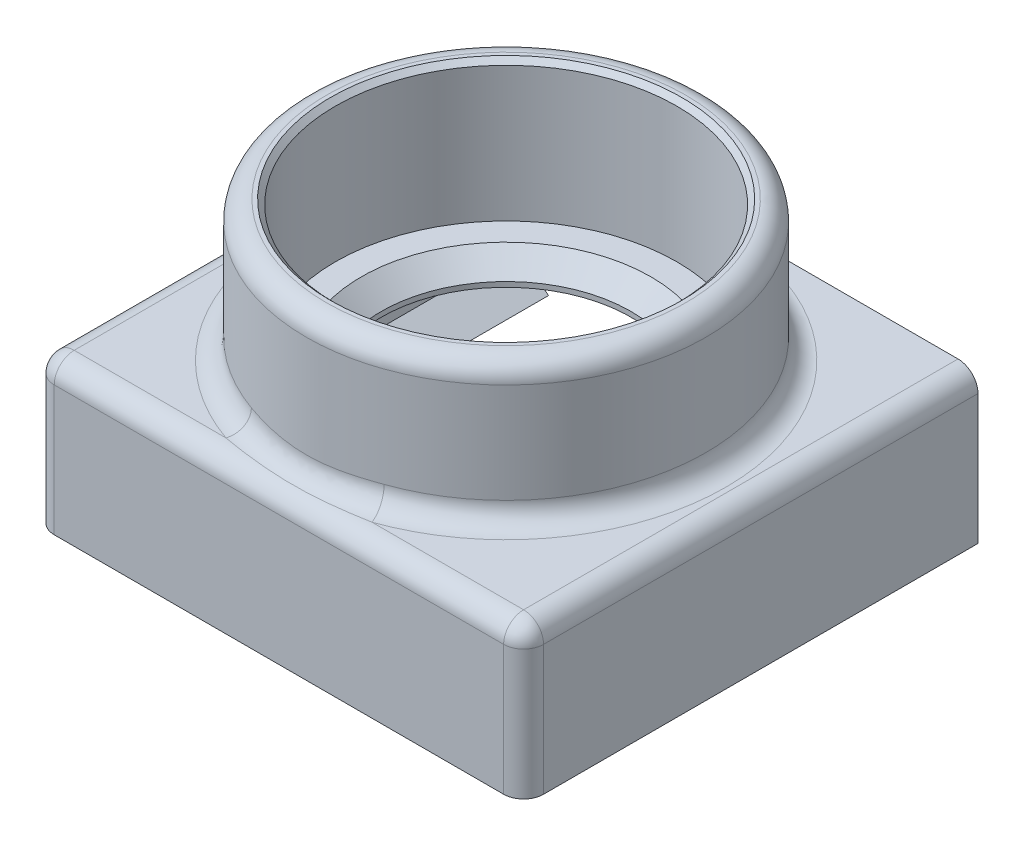
from build123d import *

# Parameters (mm, degrees)
BOSS_EXTRU_1_DEPTH      = 43.5
ESQUISSE2_W             = 2
ESQUISSE2_H             = 15
BOSS_EXTRU_2_DEPTH      = 49
ESQUISSE4_W             = 2
ESQUISSE4_H             = 8.9
BOSS_EXTRU_3_DEPTH      = 39
ESQUISSE5_W             = 5
ESQUISSE5_H             = 5
BOSS_EXTRU_4_DEPTH      = 4.5
CONG_1_R                = 2
CONG_2_R                = 2
CONG_5_R                = 2
ESQUISSE6_R             = 12.5
ENL_V_MAT_EXTRU_1_DEPTH = 2.5
CHANFREIN1_SIZE         = 2
ESQUISSE7_R             = 1.8
ENL_V_MAT_EXTRU_2_DEPTH = 3.8
CHANFREIN3_SIZE         = 0.5
ESQUISSE8_R             = 20
ESQUISSE8_R_2           = 17.1
BOSS_EXTRU_5_DEPTH      = 14
CONG_6_R                = 2
CONG_7_R                = 2
CHANFREIN4_SIZE         = 0.5


with BuildPart() as part:
    # Esquisse1 → Boss.-Extru.1 (new body)
    with BuildSketch(Plane.XY):
        Polygon((6, 0), (0, 0), (0, 15), (49, 15), (49, 0), (43, 0), (47, 3), (47, 12.5), (2, 12.5), (2, 3), align=None)
    extrude(amount=BOSS_EXTRU_1_DEPTH)

    # Esquisse2 → Boss.-Extru.2 (add)
    with BuildSketch(Plane.ZY):
        with Locations((44.5, 7.5)):
            Rectangle(ESQUISSE2_W, ESQUISSE2_H)
    extrude(amount=-BOSS_EXTRU_2_DEPTH)

    # Esquisse4 → Boss.-Extru.3 (add)
    with BuildSketch(Plane(origin=(0, 0, 43.5), x_dir=(-1, 0, 0), z_dir=(0, 0, -1))):
        with Locations((-46, 8.05)):
            Rectangle(ESQUISSE4_W, ESQUISSE4_H)
        with Locations((-3, 8.05)):
            Rectangle(ESQUISSE4_W, ESQUISSE4_H)
    extrude(amount=BOSS_EXTRU_3_DEPTH)

    # Esquisse5 → Boss.-Extru.4 (add)
    with BuildSketch(Plane(origin=(0, 0, 4.5), x_dir=(-1, 0, 0), z_dir=(0, 0, -1))):
        with Locations((-44.5, 10)):
            Rectangle(ESQUISSE5_W, ESQUISSE5_H)
        with Locations((-4.5, 10)):
            Rectangle(ESQUISSE5_W, ESQUISSE5_H)
    extrude(amount=BOSS_EXTRU_4_DEPTH)

    # Congé1
    cong_1_edges = [part.edges().sort_by_distance(p)[0] for p in [
        (45, 12.5, 24),
        (4, 12.5, 24),
    ]]
    fillet(cong_1_edges, radius=CONG_1_R)

    # Congé2
    cong_2_edges = [part.edges().sort_by_distance(p)[0] for p in [
        (42, 12.5, 2.25),
        (7, 12.5, 2.25),
    ]]
    fillet(cong_2_edges, radius=CONG_2_R)

    # Congé5
    cong_5_edges = [part.edges().sort_by_distance(p)[0] for p in [
        (0, 15, 22.75),
        (49, 15, 22.75),
        (49, 7.5, 45.5),
        (24.5, 15, 45.5),
        (0, 7.5, 45.5),
    ]]
    fillet(cong_5_edges, radius=CONG_5_R)

    # Esquisse6 → Enlèv. mat.-Extru.1 (cut)
    with BuildSketch(Plane(origin=(0, 15, 0), x_dir=(1, 0, 0), z_dir=(0, 1, 0))):
        with Locations(Location((24.5, -22.75, 0), (0, 0, 270))):
            Circle(ESQUISSE6_R)
    extrude(amount=-ENL_V_MAT_EXTRU_1_DEPTH, mode=Mode.SUBTRACT)

    # Chanfrein1
    chanfrein1_edges = [part.edges().sort_by_distance(p)[0] for p in [
        (24.5, 15, 10.25),
    ]]
    chamfer(chanfrein1_edges, length=CHANFREIN1_SIZE)

    # Esquisse7 → Enlèv. mat.-Extru.2 (cut)
    with BuildSketch(Plane(origin=(0, 0, 0), x_dir=(-1, 0, 0), z_dir=(0, 0, -1))):
        with Locations((-45.5, 11)):
            Circle(ESQUISSE7_R)
        with Locations((-3.5, 11)):
            Circle(ESQUISSE7_R)
    extrude(amount=-ENL_V_MAT_EXTRU_2_DEPTH, mode=Mode.SUBTRACT)

    # Chanfrein3
    chanfrein3_edges = [part.edges().sort_by_distance(p)[0] for p in [
        (47.3, 11, 0),
        (5.3, 11, 0),
    ]]
    chamfer(chanfrein3_edges, length=CHANFREIN3_SIZE)

    # Esquisse8 → Boss.-Extru.5 (add)
    with BuildSketch(Plane(origin=(0, 15, 0), x_dir=(1, 0, 0), z_dir=(0, 1, 0))):
        with Locations(Location((24.5, -22.75, 0), (0, 0, 90))):
            Circle(ESQUISSE8_R)
        with Locations(Location((24.5, -22.75, 0), (0, 0, 270))):
            Circle(ESQUISSE8_R_2, mode=Mode.SUBTRACT)
    extrude(amount=BOSS_EXTRU_5_DEPTH)

    # Congé6
    cong_6_edges = [part.edges().sort_by_distance(p)[0] for p in [
        (24.5, 15, 42.75),
    ]]
    fillet(cong_6_edges, radius=CONG_6_R)

    # Congé7
    cong_7_edges = [part.edges().sort_by_distance(p)[0] for p in [
        (24.5, 29, 42.75),
    ]]
    fillet(cong_7_edges, radius=CONG_7_R)

    # Chanfrein4
    chanfrein4_edges = [part.edges().sort_by_distance(p)[0] for p in [
        (24.5, 29, 5.65),
    ]]
    chamfer(chanfrein4_edges, length=CHANFREIN4_SIZE)


solid = part.part
